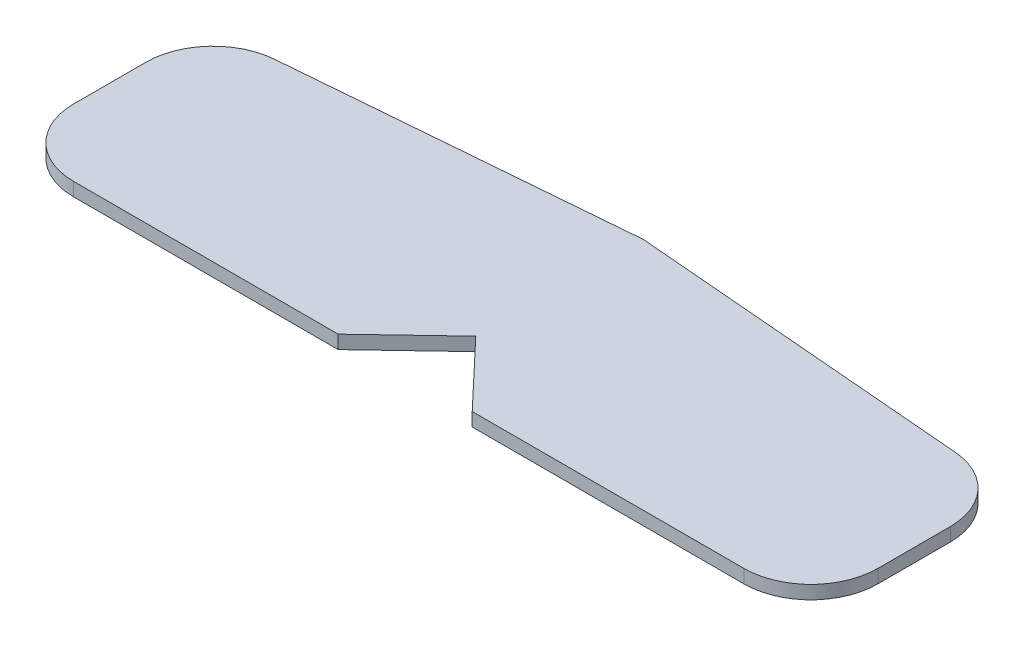
from build123d import *

# Parameters (mm, degrees)
BOSS_EXTRUDE1_DEPTH = 2


with BuildPart() as part:
    # Sketch1 → Boss-Extrude1 (new body)
    with BuildSketch(Plane(origin=(0, 0, 0), x_dir=(1, 0, 0), z_dir=(0, 1, 0))):
        with BuildLine():
            Line((-50.830454799, 13.264128767), (0, 17.5))
            Line((0, 17.5), (50.830454799, 13.264128767))
            ThreePointArc((50.830454799, 13.264128767), (57.358822867, 10.069766074), (60, 3.298671184))
            Line((60, 3.298671184), (60, -7.5))
            ThreePointArc((60, -7.5), (57.071067812, -14.571067812), (50, -17.5))
            Line((50, -17.5), (9.470954357, -17.5))
            Line((9.470954357, -17.5), (0, -7.5))
            Line((0, -7.5), (-10.529045643, -17.5))
            Line((-10.529045643, -17.5), (-50, -17.5))
            ThreePointArc((-50, -17.5), (-57.071067812, -14.571067812), (-60, -7.5))
            Line((-60, -7.5), (-60, 3.298671184))
            ThreePointArc((-60, 3.298671184), (-57.358822867, 10.069766074), (-50.830454799, 13.264128767))
        make_face()
    extrude(amount=BOSS_EXTRUDE1_DEPTH)


solid = part.part
